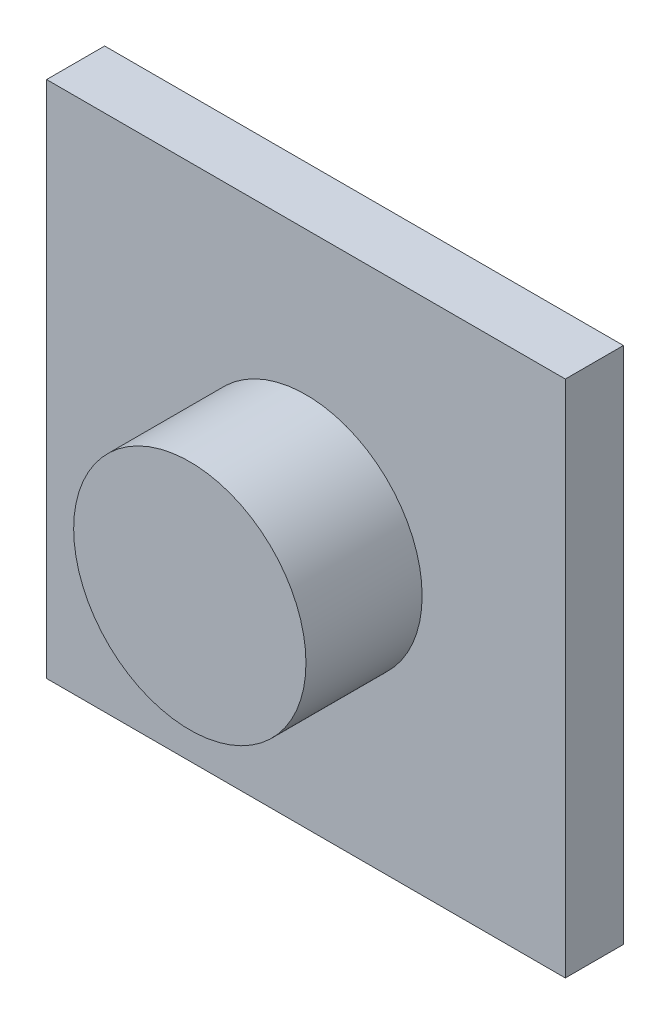
from build123d import *

# Parameters (mm, degrees)
SKETCH1_R           = 100
BOSS_EXTRUDE1_DEPTH = 100
SKETCH2_W           = 446.6
SKETCH2_H           = 446.6
BOSS_EXTRUDE2_DEPTH = 50


with BuildPart() as part:
    # Sketch1 → Boss-Extrude1 (new body)
    with BuildSketch(Plane.XY):
        Circle(SKETCH1_R)
    extrude(amount=BOSS_EXTRUDE1_DEPTH)

    # Sketch2 → Boss-Extrude2 (add)
    with BuildSketch(Plane(origin=(0, 0, 0), x_dir=(-1, 0, 0), z_dir=(0, 0, -1))):
        Rectangle(SKETCH2_W, SKETCH2_H)
    extrude(amount=BOSS_EXTRUDE2_DEPTH)


solid = part.part
